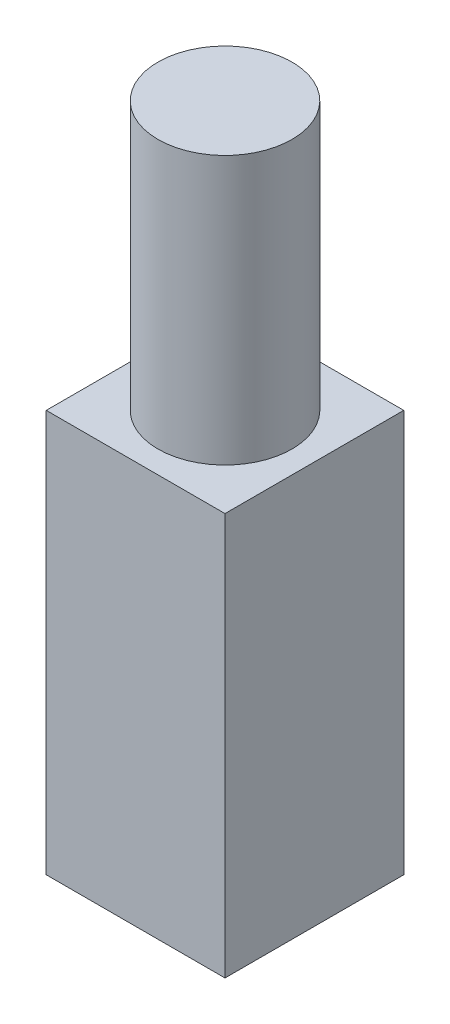
from build123d import *

# Parameters (mm, degrees)
SKETCH_3_R      = 7.5
EXTRUDE_3_DEPTH = 30
SKETCH_4_W      = 20
SKETCH_4_H      = 20
EXTRUDE_4_DEPTH = 45


with BuildPart() as part:
    # ｽｹｯﾁ3 → ﾎﾞｽ - 押し出し3 (new body)
    with BuildSketch(Plane(origin=(0, 0, 0), x_dir=(1, 0, 0), z_dir=(0, 1, 0))):
        with Locations(Location((0, 0, 0), (0, 0, 270))):
            Circle(SKETCH_3_R)
    extrude(amount=EXTRUDE_3_DEPTH)

    # ｽｹｯﾁ4 → ﾎﾞｽ - 押し出し4 (add)
    with BuildSketch(Plane.XZ):
        Rectangle(SKETCH_4_W, SKETCH_4_H)
    extrude(amount=EXTRUDE_4_DEPTH)


solid = part.part
